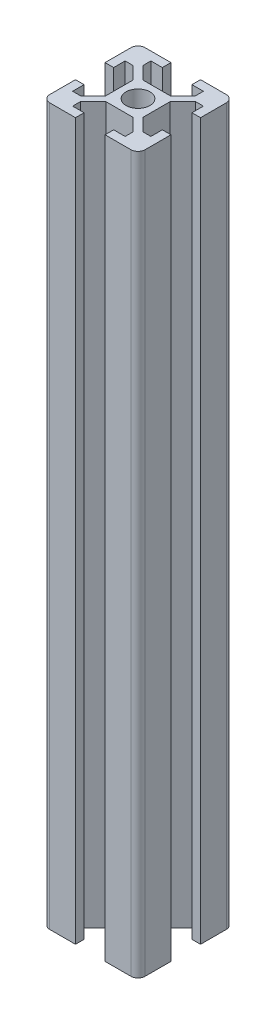
from build123d import *

# Parameters (mm, degrees)
SKETCH_2_R      = 2.5
EXTRUDE_1_DEPTH = 150


with BuildPart() as part:
    # 草图2 → 凸台-拉伸1 (new body)
    with BuildSketch(Plane(origin=(0, 0, 0), x_dir=(1, 0, 0), z_dir=(0, 1, 0))):
        with BuildLine():
            Line((-2.839339828, -3.9), (-5.5, -6.560660172))
            Line((-5.5, -6.560660172), (-5.5, -8.2))
            Line((-5.5, -8.2), (-3.1, -8.2))
            Line((-3.1, -8.2), (-3.1, -10))
            Line((-3.1, -10), (-8.5, -10))
            ThreePointArc((-8.5, -10), (-9.560660172, -9.560660172), (-10, -8.5))
            Line((-10, -8.5), (-10, -3.1))
            Line((-10, -3.1), (-8.2, -3.1))
            Line((-8.2, -3.1), (-8.2, -5.5))
            Line((-8.2, -5.5), (-6.560660172, -5.5))
            Line((-6.560660172, -5.5), (-3.9, -2.839339828))
            Line((-3.9, -2.839339828), (-3.9, 2.839339828))
            Line((-3.9, 2.839339828), (-6.560660172, 5.5))
            Line((-6.560660172, 5.5), (-8.2, 5.5))
            Line((-8.2, 5.5), (-8.2, 3.1))
            Line((-8.2, 3.1), (-10, 3.1))
            Line((-10, 3.1), (-10, 8.5))
            ThreePointArc((-10, 8.5), (-9.560660172, 9.560660172), (-8.5, 10))
            Line((-8.5, 10), (-3.1, 10))
            Line((-3.1, 10), (-3.1, 8.2))
            Line((-3.1, 8.2), (-5.5, 8.2))
            Line((-5.5, 8.2), (-5.5, 6.560660172))
            Line((-5.5, 6.560660172), (-2.839339828, 3.9))
            Line((-2.839339828, 3.9), (2.839339828, 3.9))
            Line((2.839339828, 3.9), (5.5, 6.560660172))
            Line((5.5, 6.560660172), (5.5, 8.2))
            Line((5.5, 8.2), (3.1, 8.2))
            Line((3.1, 8.2), (3.1, 10))
            Line((3.1, 10), (8.5, 10))
            ThreePointArc((8.5, 10), (9.560660172, 9.560660172), (10, 8.5))
            Line((10, 8.5), (10, 3.1))
            Line((10, 3.1), (8.2, 3.1))
            Line((8.2, 3.1), (8.2, 5.5))
            Line((8.2, 5.5), (6.560660172, 5.5))
            Line((6.560660172, 5.5), (3.9, 2.839339828))
            Line((3.9, 2.839339828), (3.9, -2.839339828))
            Line((3.9, -2.839339828), (6.560660172, -5.5))
            Line((6.560660172, -5.5), (8.2, -5.5))
            Line((8.2, -5.5), (8.2, -3.1))
            Line((8.2, -3.1), (10, -3.1))
            Line((10, -3.1), (10, -8.5))
            ThreePointArc((10, -8.5), (9.560660172, -9.560660172), (8.5, -10))
            Line((8.5, -10), (3.1, -10))
            Line((3.1, -10), (3.1, -8.2))
            Line((3.1, -8.2), (5.5, -8.2))
            Line((5.5, -8.2), (5.5, -6.560660172))
            Line((5.5, -6.560660172), (2.839339828, -3.9))
            Line((2.839339828, -3.9), (-2.839339828, -3.9))
        make_face()
        with Locations(Location((0, 0, 0), (0, 0, 270))):
            Circle(SKETCH_2_R, mode=Mode.SUBTRACT)
    extrude(amount=EXTRUDE_1_DEPTH)


solid = part.part
